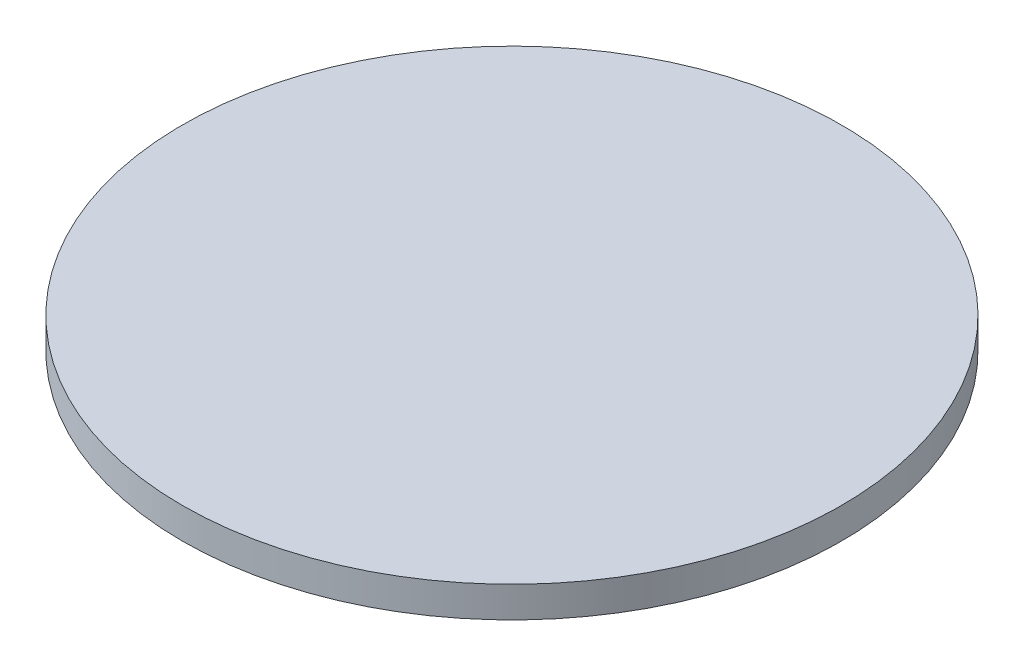
from build123d import *

# Parameters (mm, degrees)
SKETCH1_R           = 64
BOSS_EXTRUDE1_DEPTH = 6
SKETCH2_R           = 7.25
BOSS_EXTRUDE2_DEPTH = 20
SKETCH3_R           = 5
BOSS_EXTRUDE3_DEPTH = 15
SKETCH4_R           = 1.9
CUT_EXTRUDE1_DEPTH  = 10


with BuildPart() as part:
    # Sketch1 → Boss-Extrude1 (new body)
    with BuildSketch(Plane(origin=(0, 0, 0), x_dir=(1, 0, 0), z_dir=(0, 1, 0))):
        with Locations(Location((0, 0, 0), (0, 0, 270))):
            Circle(SKETCH1_R)
    extrude(amount=BOSS_EXTRUDE1_DEPTH)

    # Sketch2 → Boss-Extrude2 (add)
    with BuildSketch(Plane.XZ):
        with Locations(Location((0, 0, 0), (0, 0, 90))):
            Circle(SKETCH2_R)
    extrude(amount=BOSS_EXTRUDE2_DEPTH)

    # Sketch3 → Boss-Extrude3 (add)
    with BuildSketch(Plane.XZ.offset(20)):
        with Locations(Location((0, 0, 0), (0, 0, 270))):
            Circle(SKETCH3_R)
    extrude(amount=BOSS_EXTRUDE3_DEPTH)

    # Sketch4 → Cut-Extrude1 (cut, symmetric)
    with BuildSketch(Plane(origin=(0, 0, 0), x_dir=(0, 0, -1), z_dir=(1, 0, 0))):
        with Locations(Location((0, -31, 0), (0, 0, 180))):
            Circle(SKETCH4_R)
        with Locations(Location((0, -24, 0), (0, 0, 180))):
            Circle(SKETCH4_R)
    extrude(amount=CUT_EXTRUDE1_DEPTH, both=True, mode=Mode.SUBTRACT)


solid = part.part
